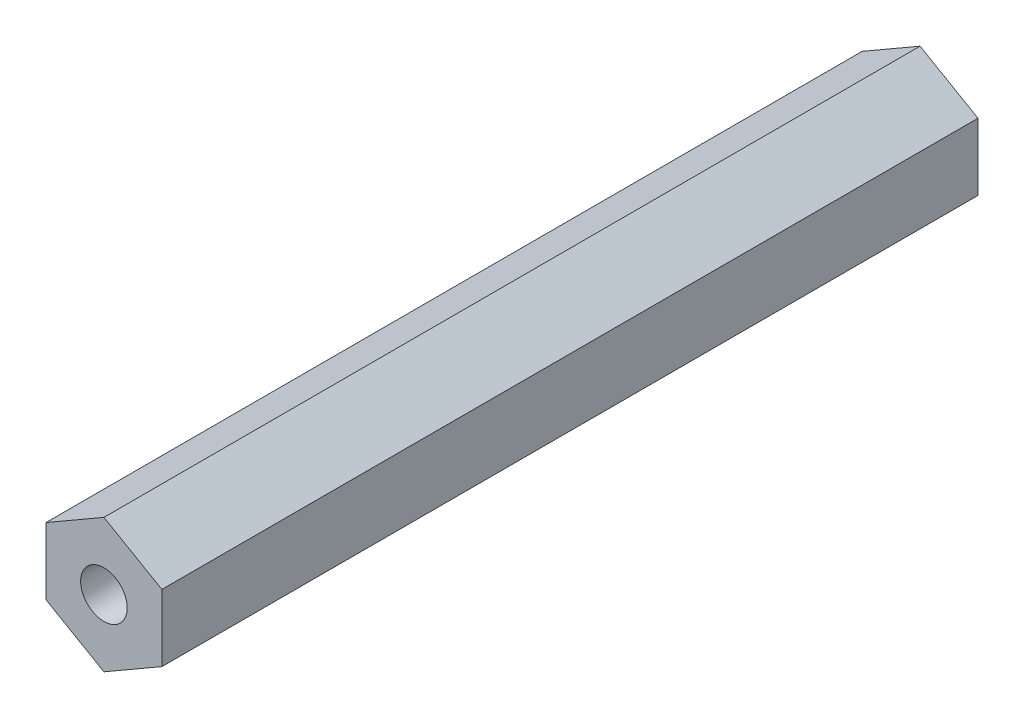
from build123d import *

# Parameters (mm, degrees)
BOSS_EXTRUDE1_DEPTH             = 44.73702
BOSS_EXTRUDE1_DEPTH_BACK        = 44.73702
TAP_DRILL_FOR_1_4_20_TAP1_D     = 5.1054
TAP_DRILL_FOR_1_4_20_TAP1_DEPTH = 19.05
TAP_DRILL_FOR_1_4_20_TAP1_TIP   = 1.533816902
TAP_DRILL_FOR_1_4_20_TAP2_D     = 5.1054
TAP_DRILL_FOR_1_4_20_TAP2_DEPTH = 19.05
TAP_DRILL_FOR_1_4_20_TAP2_TIP   = 1.533816902


with BuildPart() as part:
    # Sketch3 → Boss-Extrude1 (new, two sides: drawn at the far end of the back side and taken through both)
    with BuildSketch(Plane.XY.offset(-BOSS_EXTRUDE1_DEPTH_BACK)):
        Polygon((0, 7.332348419), (-6.35, 3.666174209), (-6.35, -3.666174209), (0, -7.332348419), (6.35, -3.666174209), (6.35, 3.666174209), align=None)
    extrude(amount=BOSS_EXTRUDE1_DEPTH + BOSS_EXTRUDE1_DEPTH_BACK)

    # Tap Drill for 1/4-20 Tap1
    with Locations(Plane(origin=(0, 0, -44.73702), x_dir=(-1, 0, 0), z_dir=(0, 0, -1))):
        with Locations((0, 0)):
            Hole(TAP_DRILL_FOR_1_4_20_TAP1_D / 2, depth=TAP_DRILL_FOR_1_4_20_TAP1_DEPTH)
            with Locations((0, 0, -(TAP_DRILL_FOR_1_4_20_TAP1_DEPTH + TAP_DRILL_FOR_1_4_20_TAP1_TIP / 2))):  # 118° drill point
                Cone(0, TAP_DRILL_FOR_1_4_20_TAP1_D / 2, TAP_DRILL_FOR_1_4_20_TAP1_TIP, mode=Mode.SUBTRACT)

    # Tap Drill for 1/4-20 Tap2
    with Locations(Plane.XY.offset(44.73702)):
        with Locations((0, 0)):
            Hole(TAP_DRILL_FOR_1_4_20_TAP2_D / 2, depth=TAP_DRILL_FOR_1_4_20_TAP2_DEPTH)
            with Locations((0, 0, -(TAP_DRILL_FOR_1_4_20_TAP2_DEPTH + TAP_DRILL_FOR_1_4_20_TAP2_TIP / 2))):  # 118° drill point
                Cone(0, TAP_DRILL_FOR_1_4_20_TAP2_D / 2, TAP_DRILL_FOR_1_4_20_TAP2_TIP, mode=Mode.SUBTRACT)


solid = part.part
